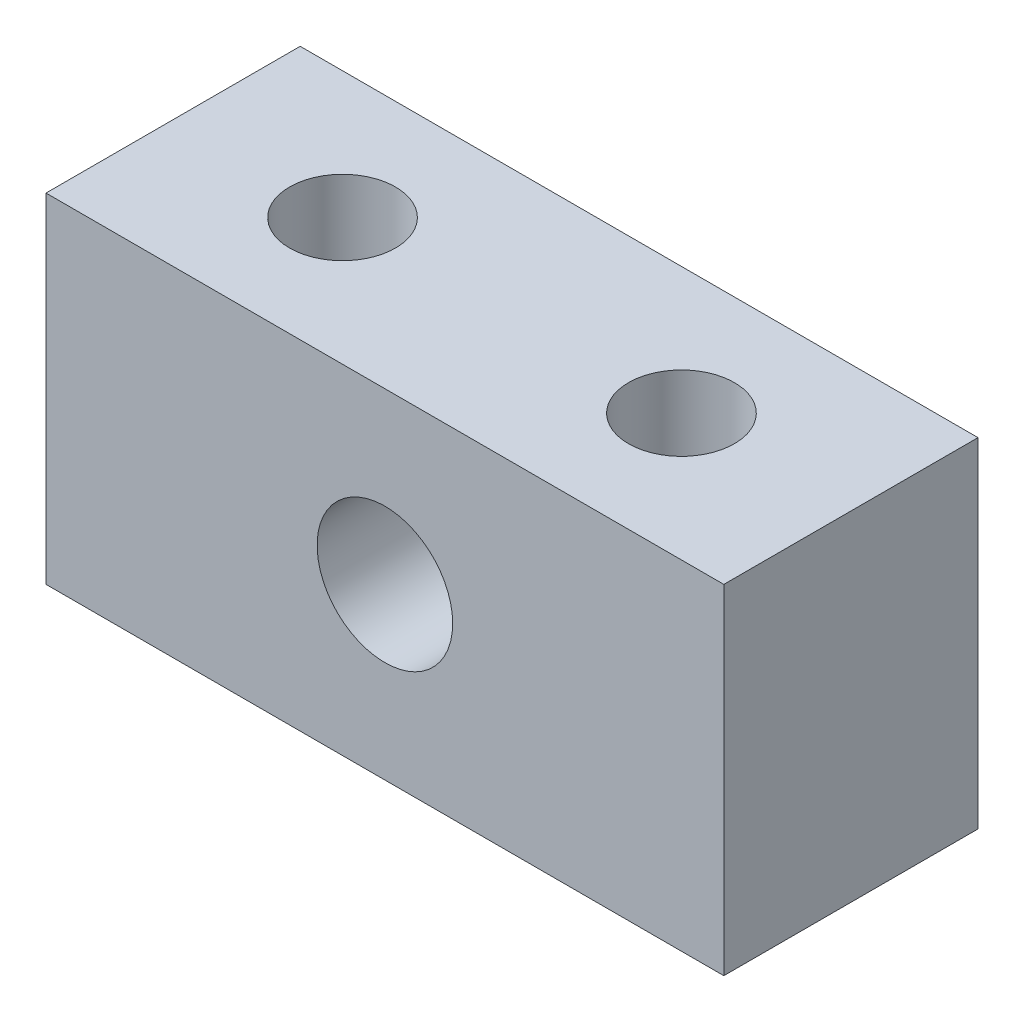
from build123d import *

# Parameters (mm, degrees)
ESQUISSE1_W                               = 16
ESQUISSE1_H                               = 8
BOSS_EXTRU_1_DEPTH                        = 6
TROU_POUR_TARAUDAGE_POUR_TROU_TARAUD_M3_D = 2.5
ESQUISSE4_R                               = 1.6
ENL_V_MAT_EXTRU_1_DEPTH                   = 6


with BuildPart() as part:
    # Esquisse1 → Boss.-Extru.1 (new body)
    with BuildSketch(Plane.XY):
        with Locations((1.433962264, 4)):
            Rectangle(ESQUISSE1_W, ESQUISSE1_H)
    extrude(amount=BOSS_EXTRU_1_DEPTH)

    # Trou pour taraudage pour trou taraudé M31 (through all)
    with Locations(Plane(origin=(0, 8, 0), x_dir=(1, 0, 0), z_dir=(0, 1, 0))):
        with Locations((-2.566037736, -3), (5.433962264, -3)):
            Hole(TROU_POUR_TARAUDAGE_POUR_TROU_TARAUD_M3_D / 2)

    # Esquisse4 → Enlèv. mat.-Extru.1 (cut)
    with BuildSketch(Plane.XY.offset(6)):
        with Locations((1.433962264, 4)):
            Circle(ESQUISSE4_R)
    extrude(amount=-ENL_V_MAT_EXTRU_1_DEPTH, mode=Mode.SUBTRACT)


solid = part.part
